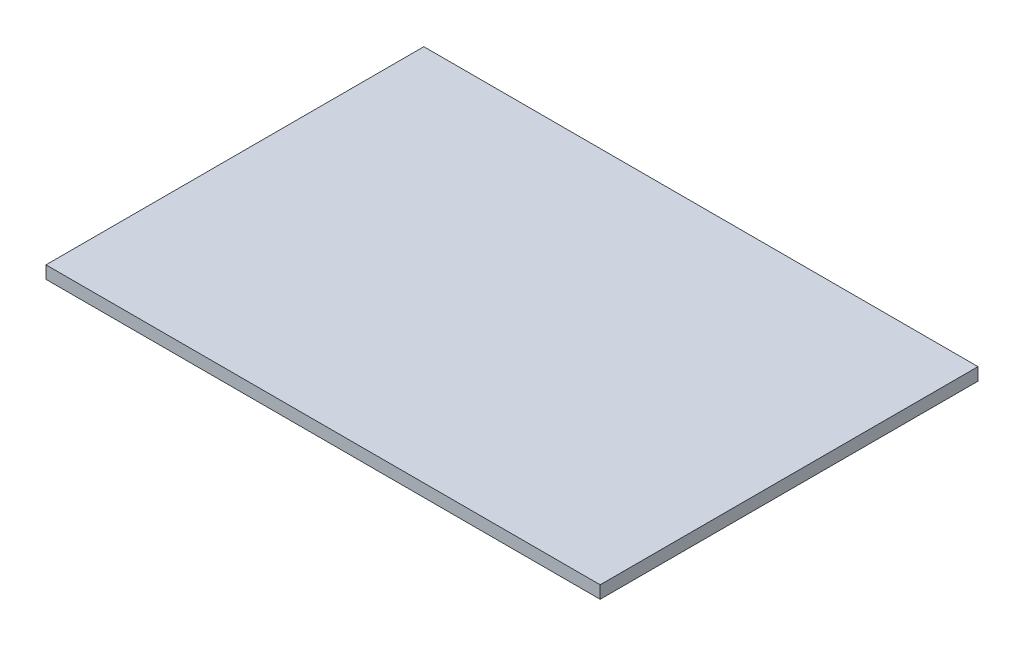
from build123d import *

# Parameters (mm, degrees)
SKETCH_1_W      = 176
SKETCH_1_H      = 120
EXTRUDE_1_DEPTH = 4


with BuildPart() as part:
    # 草图1 → 凸台-拉伸1 (new body)
    with BuildSketch(Plane(origin=(0, 0, 0), x_dir=(1, 0, 0), z_dir=(0, 1, 0))):
        Rectangle(SKETCH_1_W, SKETCH_1_H)
    extrude(amount=EXTRUDE_1_DEPTH)


solid = part.part
